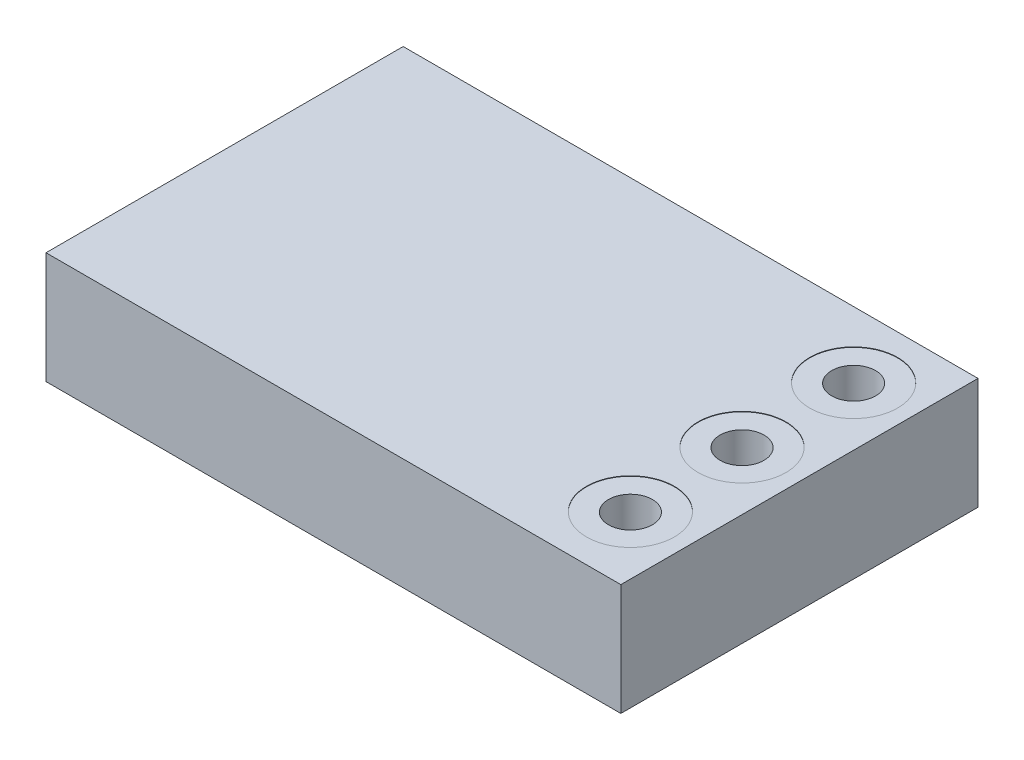
from build123d import *

# Parameters (mm, degrees)
SKETCH1_W           = 13.081
SKETCH1_H           = 8.128
BOSS_EXTRUDE1_DEPTH = 2.54
SKETCH2_R           = 0.5
CUT_EXTRUDE1_DEPTH  = 9.108380618
SKETCH3_R           = 1
CUT_EXTRUDE2_DEPTH  = 0.01


with BuildPart() as part:
    # Sketch1 → Boss-Extrude1 (new body)
    with BuildSketch(Plane(origin=(0, 0, 0), x_dir=(1, 0, 0), z_dir=(0, 1, 0))):
        Rectangle(SKETCH1_W, SKETCH1_H)
    extrude(amount=BOSS_EXTRUDE1_DEPTH)

    # Sketch2 → Cut-Extrude1 (cut, through all)
    with BuildSketch(Plane(origin=(0, 2.54, 0), x_dir=(1, 0, 0), z_dir=(0, 1, 0))):
        with Locations(Location((5.211297807, 2.563271845, 0), (0, 0, 270))):
            Circle(SKETCH2_R)
        with Locations(Location((5.211297807, 0.023271845, 0), (0, 0, 270))):
            Circle(SKETCH2_R)
        with Locations(Location((5.211297807, -2.516728155, 0), (0, 0, 270))):
            Circle(SKETCH2_R)
    extrude(amount=-CUT_EXTRUDE1_DEPTH, mode=Mode.SUBTRACT)

    # Sketch3 → Cut-Extrude2 (cut)
    with BuildSketch(Plane(origin=(0, 2.54, 0), x_dir=(1, 0, 0), z_dir=(0, 1, 0))):
        with Locations(Location((5.211297807, 2.563271845, 0), (0, 0, 270))):
            Circle(SKETCH3_R)
        with Locations(Location((5.211297807, 0.023271845, 0), (0, 0, 270))):
            Circle(SKETCH3_R)
        with Locations(Location((5.211297807, -2.516728155, 0), (0, 0, 270))):
            Circle(SKETCH3_R)
    extrude(amount=-CUT_EXTRUDE2_DEPTH, mode=Mode.SUBTRACT)


solid = part.part
